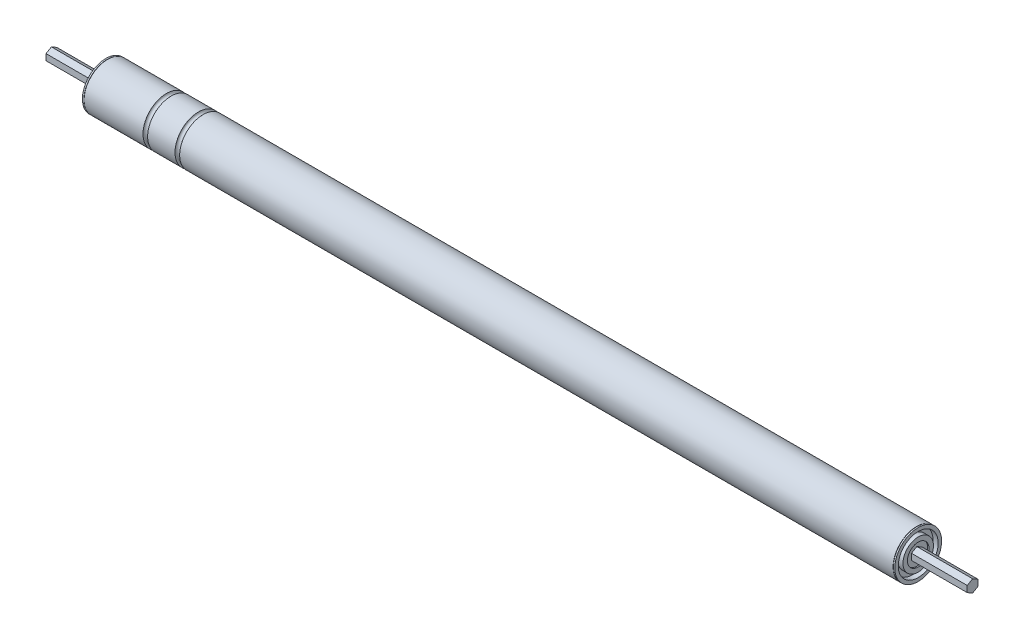
from build123d import *

# Parameters (mm, degrees)
BOSS_EXTRUDE1_START             = -411.784875
SKETCH3_R                       = 24.13
BOSS_EXTRUDE1_DEPTH             = 823.56975
CHAMFER1_SIZE                   = 0.254
BOSS_EXTRUDE3_REACH             = 833.382
SKETCH6_R                       = 24.13
SKETCH6_R_2                     = 22.352
BOSS_EXTRUDE3_DIRECTION_2_REACH = 833.382
BOSS_EXTRUDE2_DEPTH             = 431.8
BOSS_EXTRUDE2_DEPTH_BACK        = 431.8
LPATTERN1_COUNT                 = 2
LPATTERN1_PITCH                 = 33.02
BOSS_EXTRUDE4_DEPTH             = 475
BOSS_EXTRUDE5_DEPTH             = 475


with BuildPart() as part:
    # Sketch2 → Revolve1 (revolve)
    with BuildSketch(Plane.XY, mode=Mode.PRIVATE) as revolve1_sk:
        Polygon((-417.5125, 0), (-417.5125, 11.1125), (-418.896875, 11.1125), (-418.896875, 15.712927565), (-413.562875, 15.712927565), (-413.562875, 20.574), (-418.896875, 20.574), (-418.896875, 24.13), (-417.118875, 24.13), (-417.118875, 22.352), (-411.784875, 22.352), (-411.784875, 0), align=None)
    revolve(revolve1_sk.sketch.rotate(Axis((-417.5125, 0, 0), (1, 0, 0)), 180), axis=Axis((-417.5125, 0, 0), (1, 0, 0)))


with BuildPart() as body_2:
    # Mirror2: mirrored copy
    add(part.part.mirror(Plane(origin=(0, 0, 0), x_dir=(0, 0, 1), z_dir=(1, 0, 0))))


with BuildPart() as part_1:
    add(part.part)

    add(body_2.part)  # Boss-Extrude1 merges body 2
    # Sketch3 → Boss-Extrude1 (add)
    with BuildSketch(Plane(origin=(0, 0, 0), x_dir=(0, 0, -1), z_dir=(1, 0, 0)).offset(BOSS_EXTRUDE1_START)):
        with Locations(Location((0, 0, 0), (0, 0, 270))):
            Circle(SKETCH3_R)
    extrude(amount=BOSS_EXTRUDE1_DEPTH)

    # Chamfer1
    chamfer1_edges = [part_1.edges().sort_by_distance(p)[0] for p in [
        (417.118875, 24.13, 0),
        (-417.118875, 24.13, 0),
    ]]
    chamfer(chamfer1_edges, length=CHAMFER1_SIZE)

    # Boss-Extrude3: up to this face of the body (flat: up to its plane)
    boss_extrude3_end = Plane(part_1.part.faces().sort_by_distance((-417.118875, 23.20068474, 0))[0])
    # Sketch6 → Boss-Extrude3 (add, up to the picked face)
    with BuildSketch(Plane.ZY.offset(411.784875), mode=Mode.PRIVATE) as boss_extrude3_sk1:
        with Locations(Location((0, 0, 0), (0, 0, 270))):
            Circle(SKETCH6_R)
        Circle(SKETCH6_R_2, mode=Mode.SUBTRACT)
    boss_extrude3_tool1 = split(extrude(boss_extrude3_sk1.sketch, amount=BOSS_EXTRUDE3_REACH, mode=Mode.PRIVATE), bisect_by=boss_extrude3_end, keep=Keep.BOTH, mode=Mode.PRIVATE)
    add(boss_extrude3_tool1.solids().sort_by(Axis((-411.784875, 23.447501, 0), (-1, 0, 0)))[0])

    # Boss-Extrude3 direction 2: up to this face of the body (flat: up to its plane)
    boss_extrude3_direction_2_end = Plane(part_1.part.faces().sort_by_distance((417.118875, 23.20068474, 0))[0])
    # Sketch6 → Boss-Extrude3 direction 2 (add, up to the picked face)
    with BuildSketch(Plane.ZY.offset(411.784875), mode=Mode.PRIVATE) as boss_extrude3_direction_2_sk1:
        with Locations(Location((0, 0, 0), (0, 0, 270))):
            Circle(SKETCH6_R)
        Circle(SKETCH6_R_2, mode=Mode.SUBTRACT)
    boss_extrude3_direction_2_tool1 = split(extrude(boss_extrude3_direction_2_sk1.sketch, amount=-BOSS_EXTRUDE3_DIRECTION_2_REACH, mode=Mode.PRIVATE), bisect_by=boss_extrude3_direction_2_end, keep=Keep.BOTH, mode=Mode.PRIVATE)
    add(boss_extrude3_direction_2_tool1.solids().sort_by(Axis((-411.784875, 23.447501, 0), (1, 0, 0)))[0])

    # Sketch4 → Boss-Extrude2 (add, two sides: drawn at the far end of the back side and taken through both)
    with BuildSketch(Plane(origin=(0, 0, 0), x_dir=(0, 0, -1), z_dir=(1, 0, 0)).offset(-BOSS_EXTRUDE2_DEPTH_BACK)):
        Polygon((0, 6.415804866), (-5.55625, 3.207902433), (-5.55625, -3.207902433), (0, -6.415804866), (5.55625, -3.207902433), (5.55625, 3.207902433), align=None)
    extrude(amount=BOSS_EXTRUDE2_DEPTH + BOSS_EXTRUDE2_DEPTH_BACK)

    # Sketch5 → Cut-Revolve1 (revolve, cut)
    with BuildSketch(Plane.XY, mode=Mode.PRIVATE) as cut_revolve1_sk:
        with BuildLine():
            Line((-357.18115, 24.8874), (-357.18115, 25.5224))
            Line((-357.18115, 25.5224), (-350.84385, 25.5224))
            Line((-350.84385, 25.5224), (-350.84385, 24.8874))
            ThreePointArc((-350.84385, 24.8874), (-351.40062588, 24.65677588), (-351.63125, 24.1))
            ThreePointArc((-351.63125, 24.1), (-354.0125, 21.71875), (-356.39375, 24.1))
            ThreePointArc((-356.39375, 24.1), (-356.62437412, 24.65677588), (-357.18115, 24.8874))
        make_face()
    cut_revolve1 = revolve(cut_revolve1_sk.sketch.rotate(Axis((-431.8, 0, 0), (1, 0, 0)), 180), axis=Axis((-431.8, 0, 0), (1, 0, 0)), mode=Mode.SUBTRACT)

    # LPattern1: Cut-Revolve1 ×2
    with Locations(*[(i * LPATTERN1_PITCH, 0, 0) for i in range(1, LPATTERN1_COUNT)]):
        add(cut_revolve1, mode=Mode.SUBTRACT)

    # Sketch4<3> → Boss-Extrude4 (add)
    with BuildSketch(Plane(origin=(0, 0, 0), x_dir=(0, 0, -1), z_dir=(1, 0, 0))):
        Polygon((0, 6.415804866), (-5.55625, 3.207902433), (-5.55625, -3.207902433), (0, -6.415804866), (5.55625, -3.207902433), (5.55625, 3.207902433), align=None)
    extrude(amount=BOSS_EXTRUDE4_DEPTH)

    # Sketch4<4> → Boss-Extrude5 (add)
    with BuildSketch(Plane(origin=(0, 0, 0), x_dir=(0, 0, -1), z_dir=(1, 0, 0))):
        Polygon((0, 6.415804866), (-5.55625, 3.207902433), (-5.55625, -3.207902433), (0, -6.415804866), (5.55625, -3.207902433), (5.55625, 3.207902433), align=None)
    extrude(amount=-BOSS_EXTRUDE5_DEPTH)


solid = part_1.part
